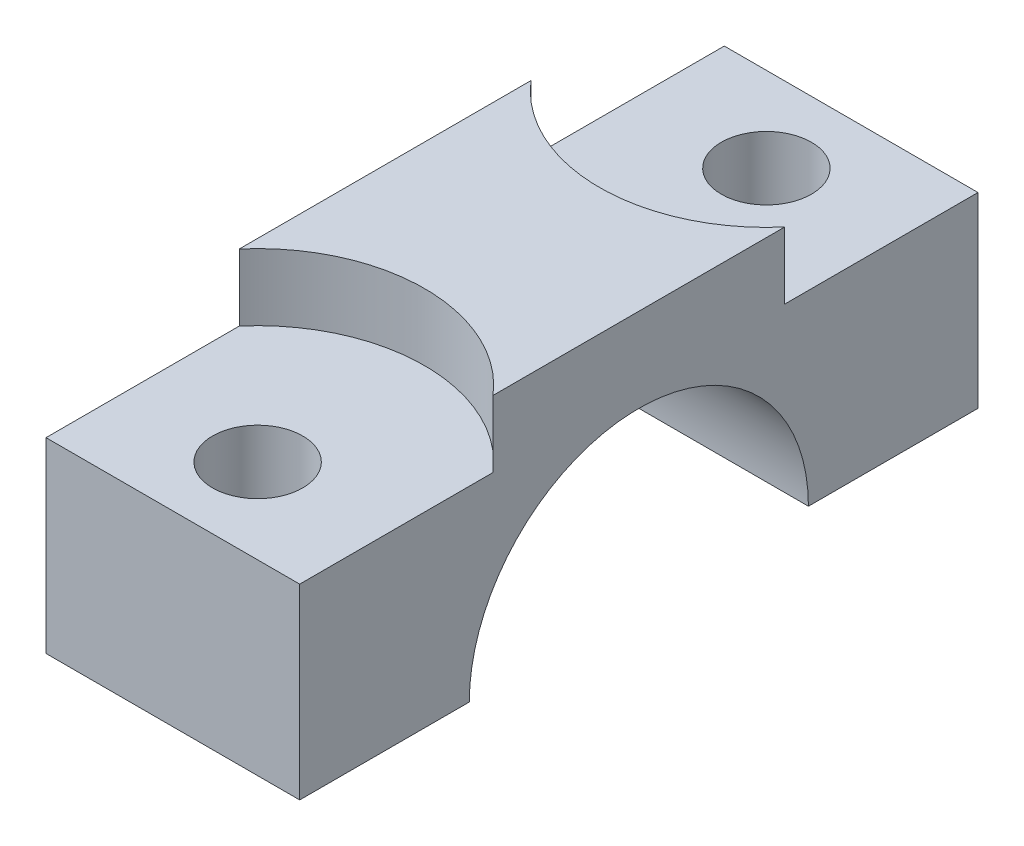
from build123d import *

# Parameters (mm, degrees)
BOSS_EXTRUDE1_DEPTH                           = 9.5
CBORE_FOR_M16_HEX_HEAD_CAP_SCREW1_D           = 6.75
CBORE_FOR_M16_HEX_HEAD_CAP_SCREW1_CBORE_D     = 25
CBORE_FOR_M16_HEX_HEAD_CAP_SCREW1_CBORE_DEPTH = 5


with BuildPart() as part:
    # Sketch1 → Boss-Extrude1 (new, symmetric)
    with BuildSketch(Plane(origin=(0, 0, 0), x_dir=(0, 0, -1), z_dir=(1, 0, 0))):
        with BuildLine():
            Line((25.4, 19), (-25.4, 19))
            Line((-25.4, 19), (-25.4, 0))
            Line((-25.4, 0), (-12.7, 0))
            ThreePointArc((-12.7, 0), (0, 12.7), (12.7, 0))
            Line((12.7, 0), (25.4, 0))
            Line((25.4, 0), (25.4, 19))
        make_face()
    extrude(amount=BOSS_EXTRUDE1_DEPTH, both=True)

    # CBORE for M16 Hex Head Cap Screw1 (through all)
    with Locations(Plane(origin=(0, 19, 0), x_dir=(1, 0, 0), z_dir=(0, 1, 0))):
        with Locations((0, 19.05), (0, -19.05)):
            CounterBoreHole(CBORE_FOR_M16_HEX_HEAD_CAP_SCREW1_D / 2, CBORE_FOR_M16_HEX_HEAD_CAP_SCREW1_CBORE_D / 2, CBORE_FOR_M16_HEX_HEAD_CAP_SCREW1_CBORE_DEPTH)


solid = part.part
